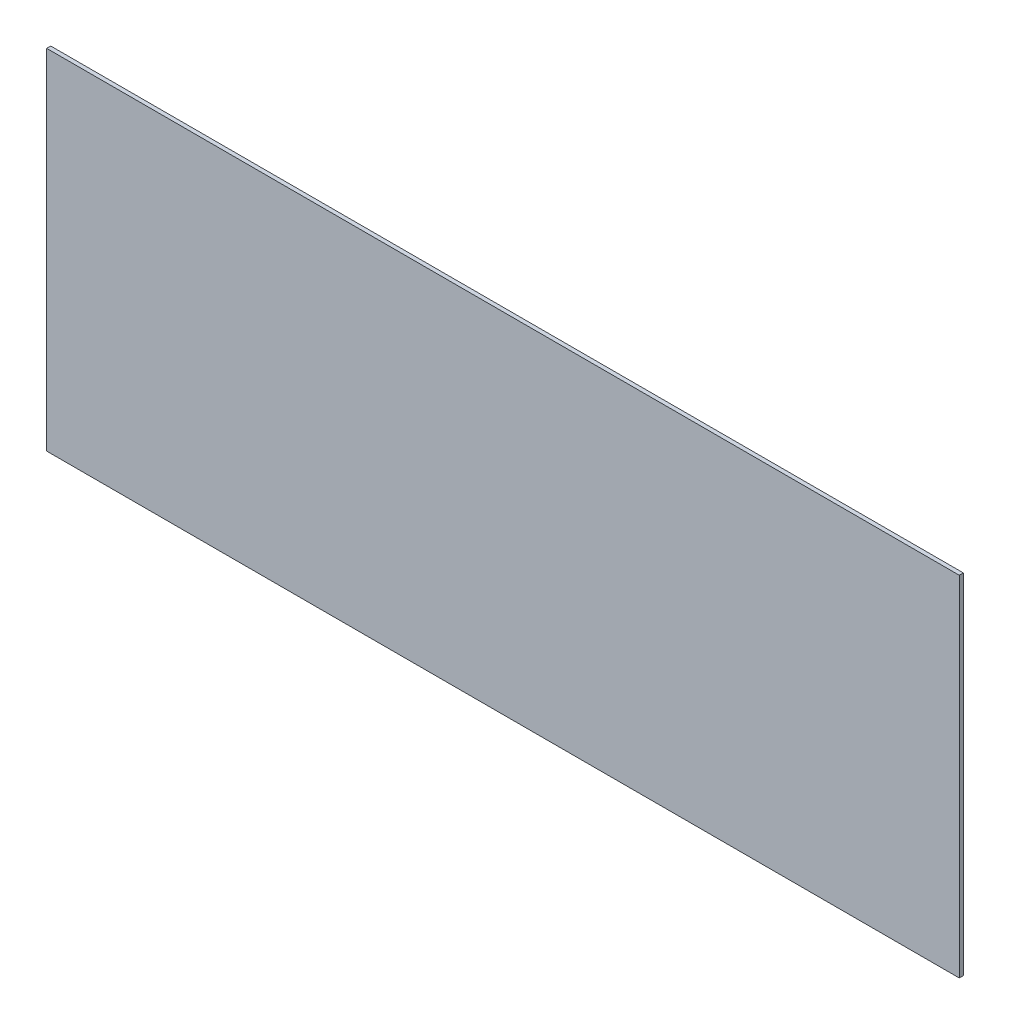
from build123d import *

# Parameters (mm, degrees)
SKETCH1_W           = 450
SKETCH1_H           = 172
BOSS_EXTRUDE1_DEPTH = 2


with BuildPart() as part:
    # Sketch1 → Boss-Extrude1 (new body)
    with BuildSketch(Plane.XY):
        Rectangle(SKETCH1_W, SKETCH1_H)
    extrude(amount=BOSS_EXTRUDE1_DEPTH)


solid = part.part
